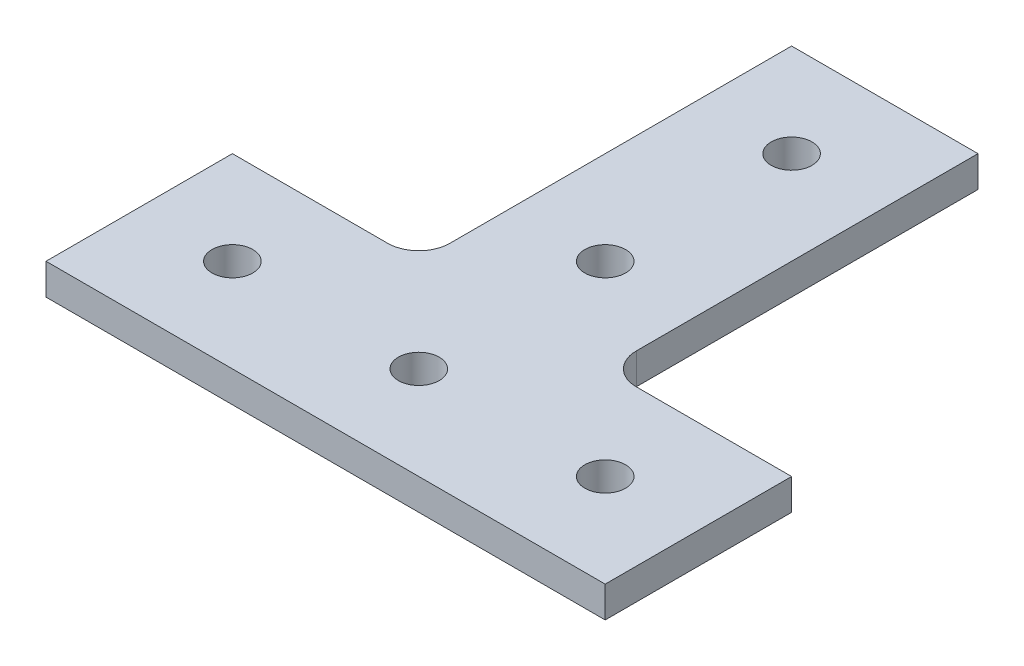
from build123d import *

# Parameters (mm, degrees)
SKETCH1_R           = 4.1656
BOSS_EXTRUDE2_DEPTH = 6.35


with BuildPart() as part:
    # Sketch1 → Boss-Extrude2 (new body)
    with BuildSketch(Plane(origin=(0, 0, 0), x_dir=(1, 0, 0), z_dir=(0, 1, 0))):
        with BuildLine():
            Line((-77.22358209, -17.628358209), (-77.22358209, 20.471641791))
            Line((-77.22358209, 20.471641791), (-45.47358209, 20.471641791))
            ThreePointArc((-45.47358209, 20.471641791), (-40.983454029, 22.331513731), (-39.12358209, 26.821641791))
            Line((-39.12358209, 26.821641791), (-39.12358209, 96.671641791))
            Line((-39.12358209, 96.671641791), (-1.02358209, 96.671641791))
            Line((-1.02358209, 96.671641791), (-1.02358209, 26.821641791))
            ThreePointArc((-1.02358209, 26.821641791), (0.83628985, 22.331513731), (5.32641791, 20.471641791))
            Line((5.32641791, 20.471641791), (37.07641791, 20.471641791))
            Line((37.07641791, 20.471641791), (37.07641791, -17.628358209))
            Line((37.07641791, -17.628358209), (-77.22358209, -17.628358209))
        make_face()
        with Locations(Location((-20.07358209, 77.621641791, 0), (0, 0, 270))):
            Circle(SKETCH1_R, mode=Mode.SUBTRACT)
        with Locations(Location((-20.07358209, 39.521641791, 0), (0, 0, 270))):
            Circle(SKETCH1_R, mode=Mode.SUBTRACT)
        with Locations(Location((-20.07358209, 1.421641791, 0), (0, 0, 270))):
            Circle(SKETCH1_R, mode=Mode.SUBTRACT)
        with Locations(Location((18.02641791, 1.421641791, 0), (0, 0, 270))):
            Circle(SKETCH1_R, mode=Mode.SUBTRACT)
        with Locations(Location((-58.17358209, 1.421641791, 0), (0, 0, 270))):
            Circle(SKETCH1_R, mode=Mode.SUBTRACT)
    extrude(amount=BOSS_EXTRUDE2_DEPTH)


solid = part.part
